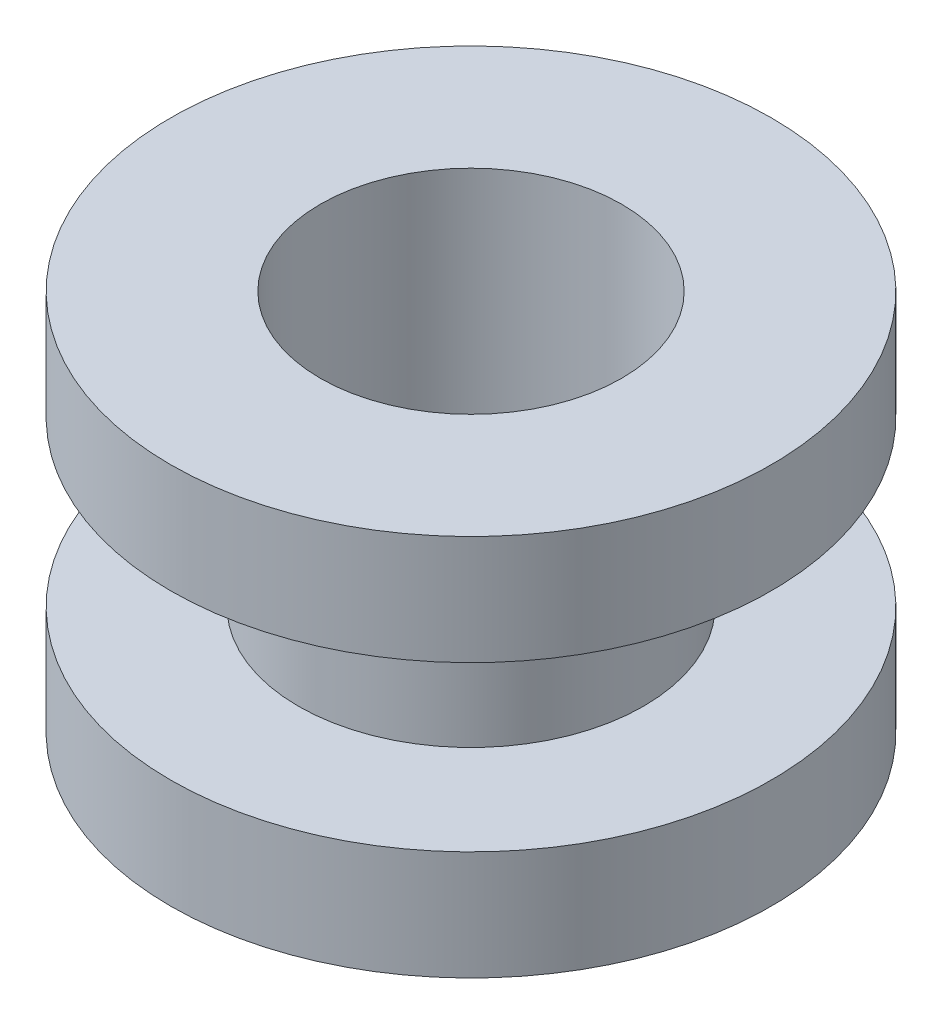
from build123d import *

# Parameters (mm, degrees)
SKETCH1_R      = 20.066
SKETCH1_R_2    = 17.526
EXTRUDE1_DEPTH = 44.45
EXTRUDE2_START = -12.7
SKETCH2_R      = 34.925
SKETCH2_R_2    = 17.526
EXTRUDE2_DEPTH = 12.7
SKETCH3_R      = 34.925
SKETCH3_R_2    = 17.526
EXTRUDE3_DEPTH = 12.7


with BuildPart() as part:
    # Sketch1 → Extrude1 (new body)
    with BuildSketch(Plane(origin=(0, 0, 0), x_dir=(1, 0, 0), z_dir=(0, 1, 0))):
        with Locations(Location((0, 0, 0), (0, 0, 270))):
            Circle(SKETCH1_R)
        with Locations(Location((0, 0, 0), (0, 0, 270))):
            Circle(SKETCH1_R_2, mode=Mode.SUBTRACT)
    extrude(amount=EXTRUDE1_DEPTH)

    # Sketch2 → Extrude2 (add)
    with BuildSketch(Plane(origin=(0, 44.45, 0), x_dir=(1, 0, 0), z_dir=(0, 1, 0)).offset(EXTRUDE2_START)):
        with Locations(Location((0, 0, 0), (0, 0, 270))):
            Circle(SKETCH2_R)
        with Locations(Location((0, 0, 0), (0, 0, 270))):
            Circle(SKETCH2_R_2, mode=Mode.SUBTRACT)
    extrude(amount=EXTRUDE2_DEPTH)

    # Sketch3 → Extrude3 (add)
    with BuildSketch(Plane.XZ):
        with Locations(Location((0, 0, 0), (0, 0, 90))):
            Circle(SKETCH3_R)
        with Locations(Location((0, 0, 0), (0, 0, 90))):
            Circle(SKETCH3_R_2, mode=Mode.SUBTRACT)
    extrude(amount=-EXTRUDE3_DEPTH)


solid = part.part
